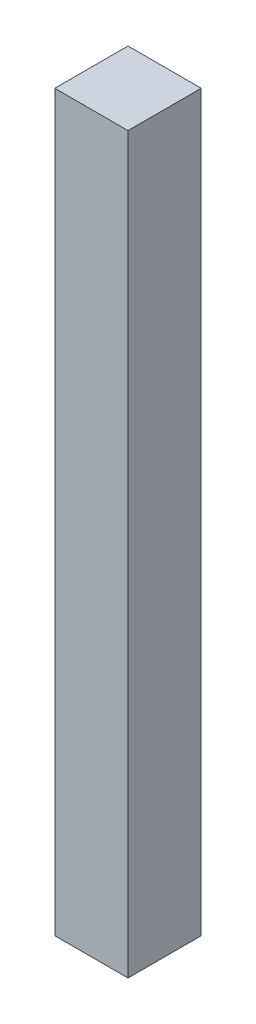
from build123d import *

# Parameters (mm, degrees)
SKETCH1_W           = 3
SKETCH1_H           = 30.06
BOSS_EXTRUDE2_DEPTH = 3


with BuildPart() as part:
    # Sketch1 → Boss-Extrude2 (new body)
    with BuildSketch(Plane.XY):
        with Locations((1.583333333, -33.954170241)):
            Rectangle(SKETCH1_W, SKETCH1_H)
    extrude(amount=BOSS_EXTRUDE2_DEPTH)


solid = part.part
